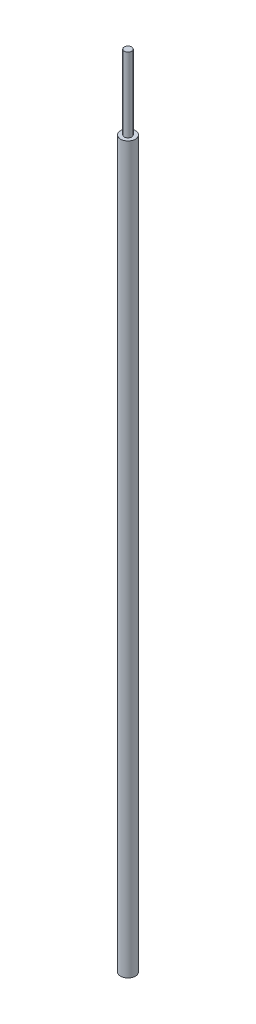
from build123d import *

# Parameters (mm, degrees)
SKETCH1_R           = 0.2
BOSS_EXTRUDE1_DEPTH = 19.5
SKETCH2_R           = 0.1
BOSS_EXTRUDE2_DEPTH = 2


with BuildPart() as part:
    # Sketch1 → Boss-Extrude1 (new body)
    with BuildSketch(Plane(origin=(0, 0, 0), x_dir=(1, 0, 0), z_dir=(0, 1, 0))):
        Circle(SKETCH1_R)
    extrude(amount=BOSS_EXTRUDE1_DEPTH)

    # Sketch2 → Boss-Extrude2 (add)
    with BuildSketch(Plane(origin=(0, 19.5, 0), x_dir=(1, 0, 0), z_dir=(0, 1, 0))):
        Circle(SKETCH2_R)
    extrude(amount=BOSS_EXTRUDE2_DEPTH)


solid = part.part
